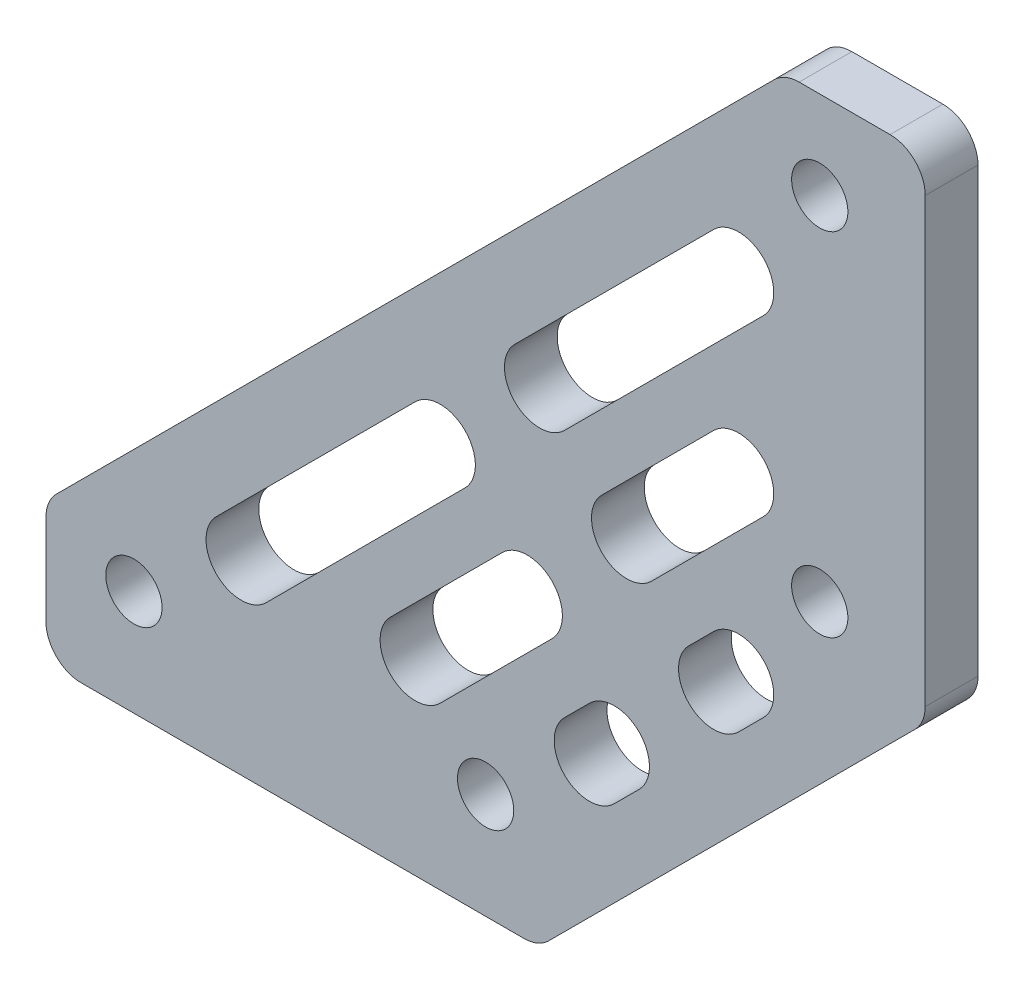
from build123d import *

# Parameters (mm, degrees)
SKETCH_1_R          = 1.6
EXTRUDE_1_DEPTH     = 3
FILLET_1_R          = 2
CUT_EXTRUDE_1_DEPTH = 10


with BuildPart() as part:
    # 草图1 → 凸台-拉伸1 (new body)
    with BuildSketch(Plane.XY):
        Polygon((0, 0), (28, 0), (50, 22), (50, 50), (42, 50), (0, 8), align=None)
        with Locations((5, 6)):
            Circle(SKETCH_1_R, mode=Mode.SUBTRACT)
        with Locations((25, 6)):
            Circle(SKETCH_1_R, mode=Mode.SUBTRACT)
        with Locations(Location((44, 45, 0), (0, 0, 180))):
            Circle(SKETCH_1_R, mode=Mode.SUBTRACT)
        with Locations(Location((44, 25, 0), (0, 0, 180))):
            Circle(SKETCH_1_R, mode=Mode.SUBTRACT)
    extrude(amount=EXTRUDE_1_DEPTH)

    # 圆角1
    fillet_1_edges = [part.edges().sort_by_distance(p)[0] for p in [
        (0, 8, 1.5),
        (42, 50, 1.5),
        (50, 50, 1.5),
        (50, 22, 1.5),
        (28, 0, 1.5),
        (0, 0, 1.5),
    ]]
    fillet(fillet_1_edges, radius=FILLET_1_R)

    # 草图2 → 切除-拉伸1 (cut)
    with BuildSketch(Plane.XY.offset(3)):
        with BuildLine():
            Line((9.686291501, 12.029437252), (21, 23.343145751))
            ThreePointArc((21, 23.343145751), (23.828427125, 23.343145751), (23.828427125, 20.514718626))
            Line((23.828427125, 20.514718626), (12.514718626, 9.201010127))
            ThreePointArc((12.514718626, 9.201010127), (9.686291501, 9.201010127), (9.686291501, 12.029437252))
        make_face()
        with BuildLine():
            Line((28.778174593, 15.564971157), (22.414213562, 9.201010127))
            ThreePointArc((22.414213562, 9.201010127), (19.585786438, 9.201010127), (19.585786438, 12.029437252))
            Line((19.585786438, 12.029437252), (25.949747468, 18.393398282))
            ThreePointArc((25.949747468, 18.393398282), (28.778174593, 18.393398282), (28.778174593, 15.564971157))
        make_face()
        with BuildLine():
            Line((29.485281374, 12.029437252), (30.899494937, 13.443650814))
            ThreePointArc((30.899494937, 13.443650814), (33.727922061, 13.443650814), (33.727922061, 10.615223689))
            Line((33.727922061, 10.615223689), (32.313708499, 9.201010127))
            ThreePointArc((32.313708499, 9.201010127), (29.485281374, 9.201010127), (29.485281374, 12.029437252))
        make_face()
        with BuildLine():
            Line((37.970562748, 40.313708499), (26.656854249, 29))
            ThreePointArc((26.656854249, 29), (26.656854249, 26.171572875), (29.485281374, 26.171572875))
            Line((29.485281374, 26.171572875), (40.798989873, 37.485281374))
            ThreePointArc((40.798989873, 37.485281374), (40.798989873, 40.313708499), (37.970562748, 40.313708499))
        make_face()
        with BuildLine():
            Line((34.435028843, 21.221825407), (40.798989873, 27.585786438))
            ThreePointArc((40.798989873, 27.585786438), (40.798989873, 30.414213562), (37.970562748, 30.414213562))
            Line((37.970562748, 30.414213562), (31.606601718, 24.050252532))
            ThreePointArc((31.606601718, 24.050252532), (31.606601718, 21.221825407), (34.435028843, 21.221825407))
        make_face()
        with BuildLine():
            Line((37.970562748, 20.514718626), (36.556349186, 19.100505063))
            ThreePointArc((36.556349186, 19.100505063), (36.556349186, 16.272077939), (39.384776311, 16.272077939))
            Line((39.384776311, 16.272077939), (40.798989873, 17.686291501))
            ThreePointArc((40.798989873, 17.686291501), (40.798989873, 20.514718626), (37.970562748, 20.514718626))
        make_face()
    extrude(amount=-CUT_EXTRUDE_1_DEPTH, mode=Mode.SUBTRACT)


solid = part.part
